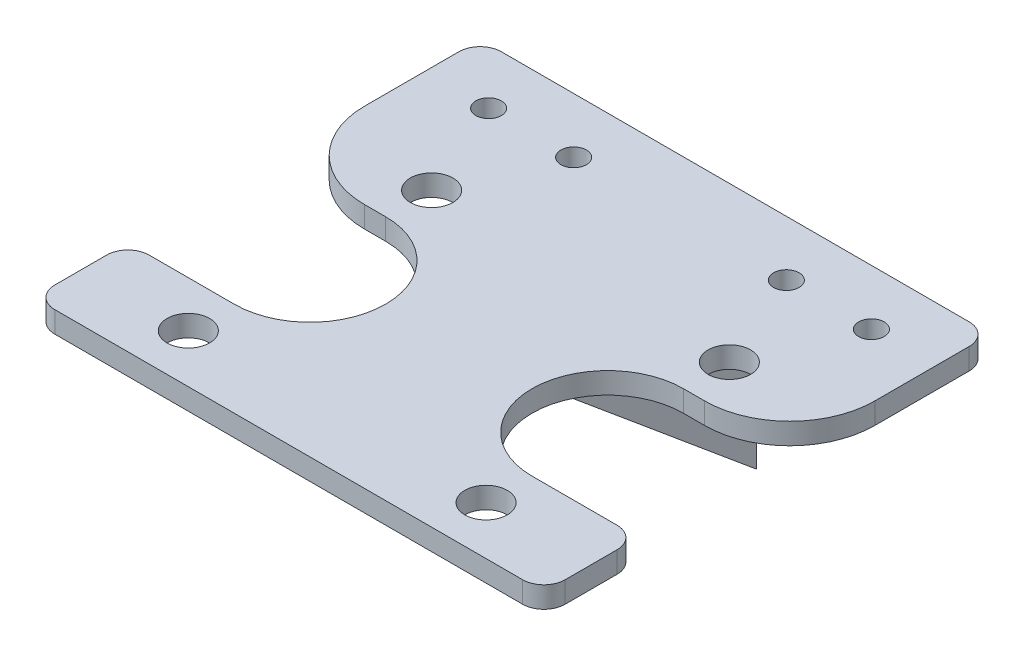
from build123d import *

# Parameters (mm, degrees)
SKETCH1_R           = 5
SKETCH1_R_2         = 3
BOSS_EXTRUDE2_DEPTH = 5
BOSS_EXTRUDE3_DEPTH = 5
FILLET1_R           = 20
FILLET2_R           = 5


with BuildPart() as part:
    # Sketch1 → Boss-Extrude2 (new body)
    with BuildSketch(Plane(origin=(0, 0, 0), x_dir=(1, 0, 0), z_dir=(0, 1, 0))):
        with BuildLine():
            Line((60, 2.8), (60, 50))
            Line((60, 50), (-60, 50))
            Line((-60, 50), (-60, 2.8))
            Line((-60, 2.8), (-35, 2.8))
            ThreePointArc((-35, 2.8), (-17.2, -15), (-35, -32.8))
            Line((-35, -32.8), (-60, -32.8))
            Line((-60, -32.8), (-60, -55))
            Line((-60, -55), (60, -55))
            Line((60, -55), (60, -32.8))
            Line((60, -32.8), (35, -32.8))
            ThreePointArc((35, -32.8), (17.2, -15), (35, 2.8))
            Line((35, 2.8), (60, 2.8))
        make_face()
        with Locations(Location((-35, 13.6, 0), (0, 0, 270))):
            Circle(SKETCH1_R, mode=Mode.SUBTRACT)
        with Locations(Location((-35, -43.6, 0), (0, 0, 270))):
            Circle(SKETCH1_R, mode=Mode.SUBTRACT)
        with Locations(Location((35, 13.6, 0), (0, 0, 270))):
            Circle(SKETCH1_R, mode=Mode.SUBTRACT)
        with Locations(Location((35, -43.6, 0), (0, 0, 270))):
            Circle(SKETCH1_R, mode=Mode.SUBTRACT)
        with Locations(Location((-45, 37, 0), (0, 0, 270))):
            Circle(SKETCH1_R_2, mode=Mode.SUBTRACT)
        with Locations(Location((-25, 37, 0), (0, 0, 270))):
            Circle(SKETCH1_R_2, mode=Mode.SUBTRACT)
        with Locations(Location((25, 37, 0), (0, 0, 270))):
            Circle(SKETCH1_R_2, mode=Mode.SUBTRACT)
        with Locations(Location((45, 37, 0), (0, 0, 270))):
            Circle(SKETCH1_R_2, mode=Mode.SUBTRACT)
    extrude(amount=-BOSS_EXTRUDE2_DEPTH)

    # Sketch2 → Boss-Extrude3 (add, symmetric)
    with BuildSketch(Plane(origin=(0, 0, 0), x_dir=(0, 0, -1), z_dir=(1, 0, 0))):
        Polygon((-10, -5), (50, -55), (50, -5), align=None)
    extrude(amount=BOSS_EXTRUDE3_DEPTH, both=True)

    # Fillet1
    fillet1_edges = [part.edges().sort_by_distance(p)[0] for p in [
        (60, -2.5, -2.8),
        (-60, -2.5, -2.8),
    ]]
    fillet(fillet1_edges, radius=FILLET1_R)

    # Fillet2
    fillet2_edges = [part.edges().sort_by_distance(p)[0] for p in [
        (60, -2.5, -50),
        (60, -2.5, 32.8),
        (60, -2.5, 55),
        (-60, -2.5, 55),
        (-60, -2.5, 32.8),
        (-60, -2.5, -50),
    ]]
    fillet(fillet2_edges, radius=FILLET2_R)


solid = part.part
